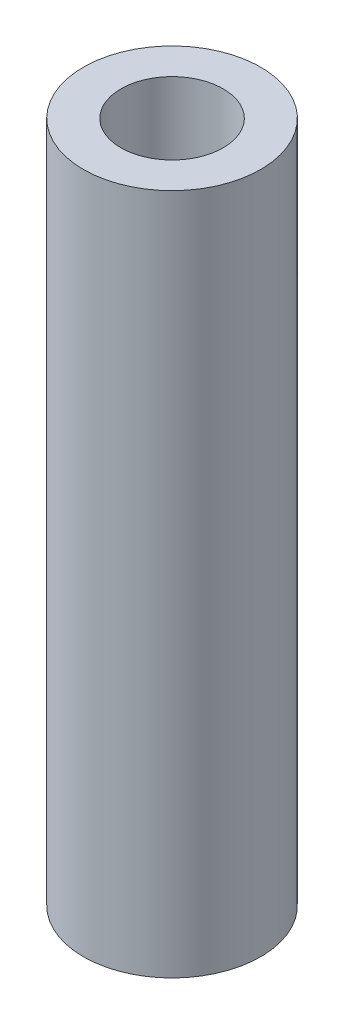
from build123d import *

# Parameters (mm, degrees)
SKETCH_1_R      = 2.6
SKETCH_1_R_2    = 1.5
EXTRUDE_1_DEPTH = 20


with BuildPart() as part:
    # 草图1 → 凸台-拉伸1 (new body)
    with BuildSketch(Plane(origin=(0, 0, 0), x_dir=(1, 0, 0), z_dir=(0, 1, 0))):
        with Locations(Location((0, 0, 0), (0, 0, 270))):
            Circle(SKETCH_1_R)
        with Locations(Location((0, 0, 0), (0, 0, 270))):
            Circle(SKETCH_1_R_2, mode=Mode.SUBTRACT)
    extrude(amount=EXTRUDE_1_DEPTH)


solid = part.part
